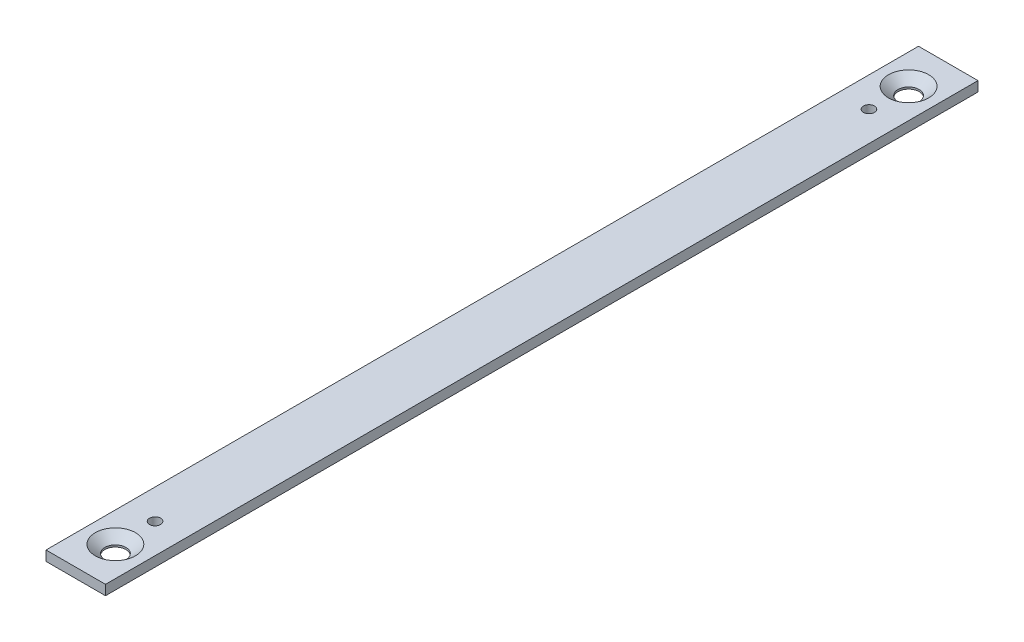
from build123d import *

# Parameters (mm, degrees)
SKETCH1_W                                   = 19.05
SKETCH1_H                                   = 279.4
SKETCH1_R                                   = 1.778
BOSS_EXTRUDE1_DEPTH                         = 3.175
CSK_FOR_1_4_FLAT_HEAD_MACHINE_SCREW_2_COUNT = 2
CSK_FOR_1_4_FLAT_HEAD_MACHINE_SCREW_2_PITCH = 254


with BuildPart() as part:
    # Sketch1 → Boss-Extrude1 (new body)
    with BuildSketch(Plane(origin=(0, 0, 0), x_dir=(1, 0, 0), z_dir=(0, 1, 0))):
        Rectangle(SKETCH1_W, SKETCH1_H)
        with Locations(Location((0, 114.3, 0), (0, 0, 270))):
            Circle(SKETCH1_R, mode=Mode.SUBTRACT)
        with Locations(Location((0, -114.3, 0), (0, 0, 270))):
            Circle(SKETCH1_R, mode=Mode.SUBTRACT)
    extrude(amount=-BOSS_EXTRUDE1_DEPTH)

    # Sketch3 → CSK for 1/4 Flat Head Machine Screw (100)1 (revolve, cut)
    with BuildSketch(Plane(origin=(0, 0, 127), x_dir=(0, 0, 1), z_dir=(1, 0, 0))):
        Polygon((0, 0), (0, 3.175), (3.3782, 3.175), (3.3782, 2.568232241), (6.4389, 0), align=None)
    csk_for_1_4_flat_head_machine_screw_100 = revolve(axis=Axis((0, 6.35, 127), (0, -1, 0)), mode=Mode.SUBTRACT)

    # CSK for 1_4 Flat Head Machine Screw  2: CSK for 1/4 Flat Head Machine Screw (100)1 ×2
    with Locations(*[(0, 0, -i * CSK_FOR_1_4_FLAT_HEAD_MACHINE_SCREW_2_PITCH) for i in range(1, CSK_FOR_1_4_FLAT_HEAD_MACHINE_SCREW_2_COUNT)]):
        add(csk_for_1_4_flat_head_machine_screw_100, mode=Mode.SUBTRACT)


solid = part.part
